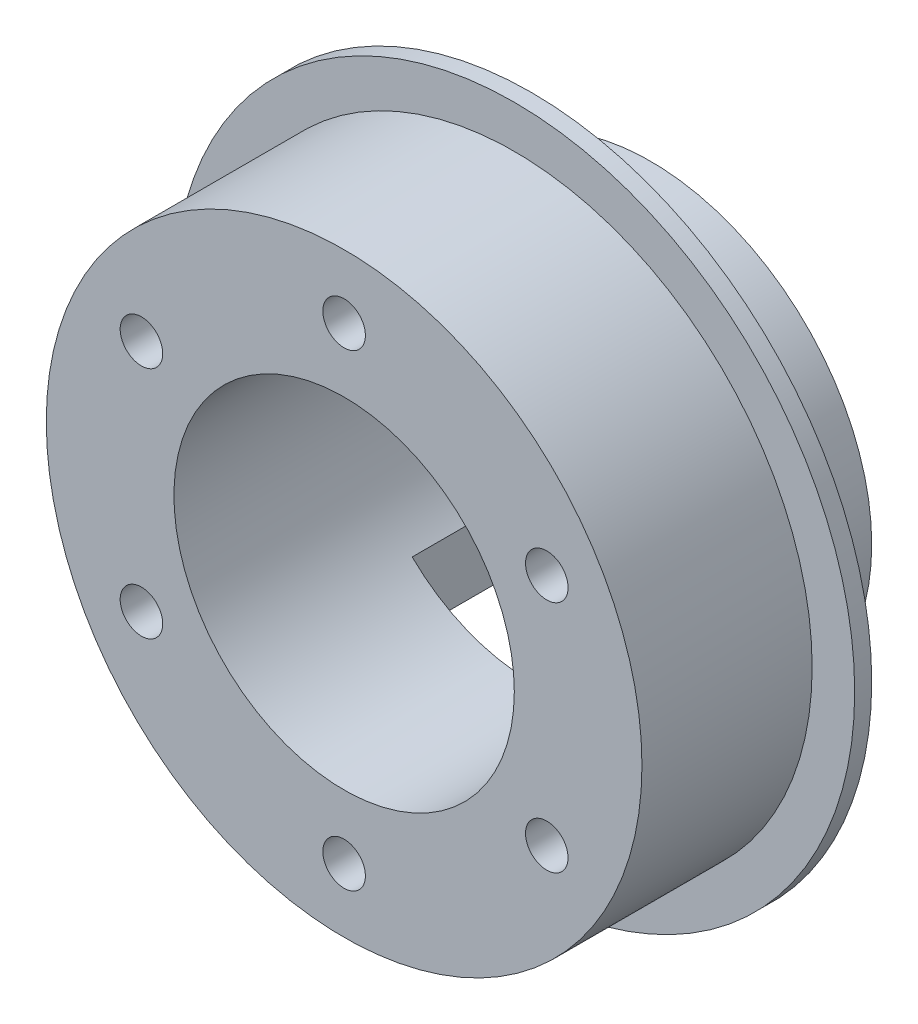
from build123d import *

# Parameters (mm, degrees)
SKETCH_1_R               = 13
EXTRUDE_1_DEPTH          = 2
SKETCH_2_R               = 13
SKETCH_2_R_2             = 10
EXTRUDE_2_DEPTH          = 5
SKETCH_4_R               = 20
SKETCH_4_R_2             = 10
EXTRUDE_3_DEPTH          = 1
SKETCH_5_R               = 17.5
SKETCH_5_R_2             = 10
EXTRUDE_4_DEPTH          = 10
SKETCH_6_R               = 1.25
CUT_EXTRUDE_1_DEPTH      = 8
SKETCH_7_R               = 3
SKETCH_7_R_2             = 1
CUT_EXTRUDE_2_DEPTH      = 34.526109228
CUT_EXTRUDE_3_DEPTH      = 34.526109228
CUT_EXTRUDE_3_DEPTH_BACK = 34.526109228
SKETCH_8_W               = 14
SKETCH_8_H               = 5


with BuildPart() as part:
    # 스케치1 → 보스-돌출1 (new body)
    with BuildSketch(Plane.XY):
        Circle(SKETCH_1_R)
    extrude(amount=EXTRUDE_1_DEPTH)

    # 스케치2 → 보스-돌출2 (add)
    with BuildSketch(Plane.XY.offset(2)):
        Circle(SKETCH_2_R)
        Circle(SKETCH_2_R_2, mode=Mode.SUBTRACT)
    extrude(amount=EXTRUDE_2_DEPTH)

    # 스케치4 → 보스-돌출3 (add)
    with BuildSketch(Plane.XY.offset(7)):
        Circle(SKETCH_4_R)
        Circle(SKETCH_4_R_2, mode=Mode.SUBTRACT)
    extrude(amount=EXTRUDE_3_DEPTH)

    # 스케치5 → 보스-돌출4 (add)
    with BuildSketch(Plane.XY.offset(8)):
        Circle(SKETCH_5_R)
        Circle(SKETCH_5_R_2, mode=Mode.SUBTRACT)
    extrude(amount=EXTRUDE_4_DEPTH)

    # 스케치6 → 컷-돌출1 (cut)
    with BuildSketch(Plane.XY.offset(18)):
        with Locations((11.907849302, 6.875)):
            Circle(SKETCH_6_R)
        with Locations((11.907849302, -6.875)):
            Circle(SKETCH_6_R)
        with Locations((0, -13.75)):
            Circle(SKETCH_6_R)
        with Locations((-11.907849302, -6.875)):
            Circle(SKETCH_6_R)
        with Locations((-11.907849302, 6.875)):
            Circle(SKETCH_6_R)
        with Locations((0, 13.75)):
            Circle(SKETCH_6_R)
    extrude(amount=-CUT_EXTRUDE_1_DEPTH, mode=Mode.SUBTRACT)

    # 스케치7 → 컷-돌출2 (cut, through all)
    with BuildSketch(Plane(origin=(0, 0, 0), x_dir=(-1, 0, 0), z_dir=(0, 0, -1))):
        Circle(SKETCH_7_R)
        with Locations((0, 7)):
            Circle(SKETCH_7_R_2)
        with Locations((0, -7)):
            Circle(SKETCH_7_R_2)
        with Locations((-7, 3)):
            Circle(SKETCH_7_R_2)
        with Locations((-7, -3)):
            Circle(SKETCH_7_R_2)
        with Locations((7, 3)):
            Circle(SKETCH_7_R_2)
        with Locations((7, -3)):
            Circle(SKETCH_7_R_2)
    extrude(amount=-CUT_EXTRUDE_2_DEPTH, mode=Mode.SUBTRACT)

    # 스케치8 → 컷-돌출3 (cut, two sides: drawn at the far end of the back side and taken through both)
    with BuildSketch(Plane(origin=(0, 0, 0), x_dir=(1, 0, 0), z_dir=(0, 1, 0)).offset(-CUT_EXTRUDE_3_DEPTH_BACK)):
        with Locations((0, -4.5)):
            Rectangle(SKETCH_8_W, SKETCH_8_H)
    extrude(amount=CUT_EXTRUDE_3_DEPTH + CUT_EXTRUDE_3_DEPTH_BACK, mode=Mode.SUBTRACT)


solid = part.part
